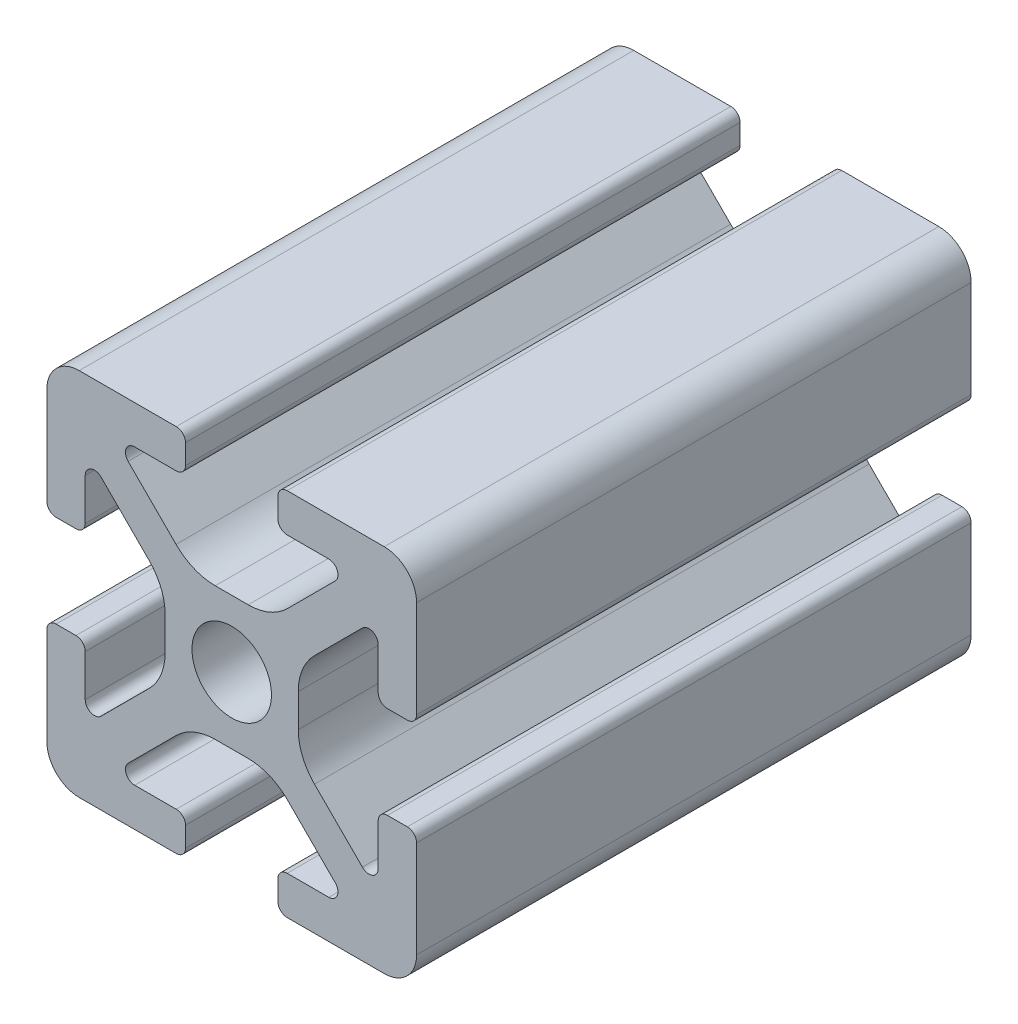
from build123d import *

# Parameters (mm, degrees)
BOSS_EXTRUDE1_DEPTH = 15


with BuildPart() as part:
    # Sketch4 → Boss-Extrude1 (new, symmetric)
    with BuildSketch(Plane.XY):
        with BuildLine():
            Line((3, -10), (8.25, -10))
            ThreePointArc((8.25, -10), (9.487436867, -9.487436867), (10, -8.25))
            Line((10, -8.25), (10, -3))
            ThreePointArc((10, -3), (9.853553391, -2.646446609), (9.5, -2.5))
            Line((9.5, -2.5), (8.424621202, -2.5))
            ThreePointArc((8.424621202, -2.5), (8.071067812, -2.646446609), (7.924621202, -3))
            Line((7.924621202, -3), (7.924621202, -5.25))
            ThreePointArc((7.924621202, -5.25), (7.615962919, -5.711939766), (7.071067812, -5.603553391))
            Line((7.071067812, -5.603553391), (4.478679656, -3.011165235))
            ThreePointArc((4.478679656, -3.011165235), (3.828361402, -2.037895189), (3.6, -0.889844892))
            Line((3.6, -0.889844892), (3.6, 0))
            Line((3.6, 0), (2.15, 0))
            ThreePointArc((2.15, 0), (1.52027958, -1.52027958), (0, -2.15))
            Line((0, -2.15), (0, -3.6))
            Line((0, -3.6), (0.889844892, -3.6))
            ThreePointArc((0.889844892, -3.6), (2.037895189, -3.828361402), (3.011165235, -4.478679656))
            Line((3.011165235, -4.478679656), (5.603553391, -7.071067812))
            ThreePointArc((5.603553391, -7.071067812), (5.711939766, -7.615962919), (5.25, -7.924621202))
            Line((5.25, -7.924621202), (3, -7.924621202))
            ThreePointArc((3, -7.924621202), (2.646446609, -8.071067812), (2.5, -8.424621202))
            Line((2.5, -8.424621202), (2.5, -9.5))
            ThreePointArc((2.5, -9.5), (2.646446609, -9.853553391), (3, -10))
        make_face()
    extrude(amount=BOSS_EXTRUDE1_DEPTH, both=True)

    # Mirror1: part across plane


with BuildPart() as part_1:
    add(part.part)
    add(part.part.mirror(Plane(origin=(0, 0, 0), x_dir=(0, 0, 1), z_dir=(1, 0, 0))))

    # Mirror2: part across plane


with BuildPart() as part_2:
    add(part_1.part)
    add(part_1.part.mirror(Plane.ZX))


solid = part_2.part
